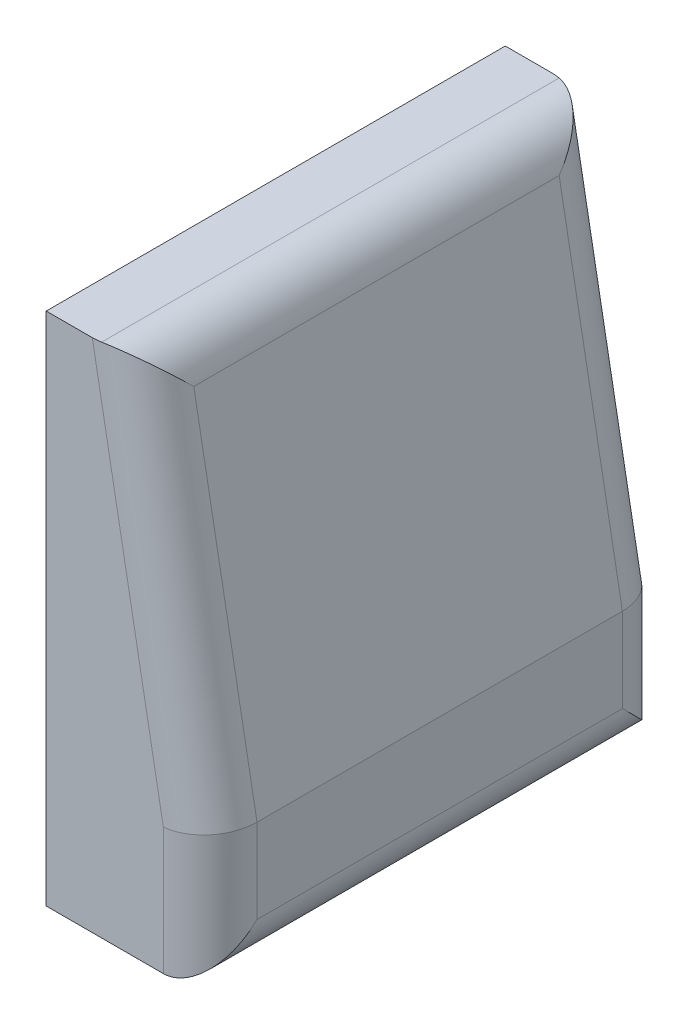
from build123d import *

# Parameters (mm, degrees)
BOSS_EXTRUDE1_DEPTH = 490
FILLET1_R           = 100


with BuildPart() as part:
    # Sketch1 → Boss-Extrude1 (new, symmetric)
    with BuildSketch(Plane.XY):
        Polygon((0, 664.4), (0, -435.6), (350, -435.6), (350, -155.6), (200, 664.4), align=None)
    extrude(amount=BOSS_EXTRUDE1_DEPTH, both=True)

    # Fillet1
    fillet1_edges = [part.edges().sort_by_distance(p)[0] for p in [
        (350, -295.6, 490),
        (275, 254.4, 490),
        (275, 254.4, -490),
        (350, -295.6, -490),
        (200, 664.4, 0),
        (350, -435.6, 0),
    ]]
    fillet(fillet1_edges, radius=FILLET1_R)


solid = part.part
